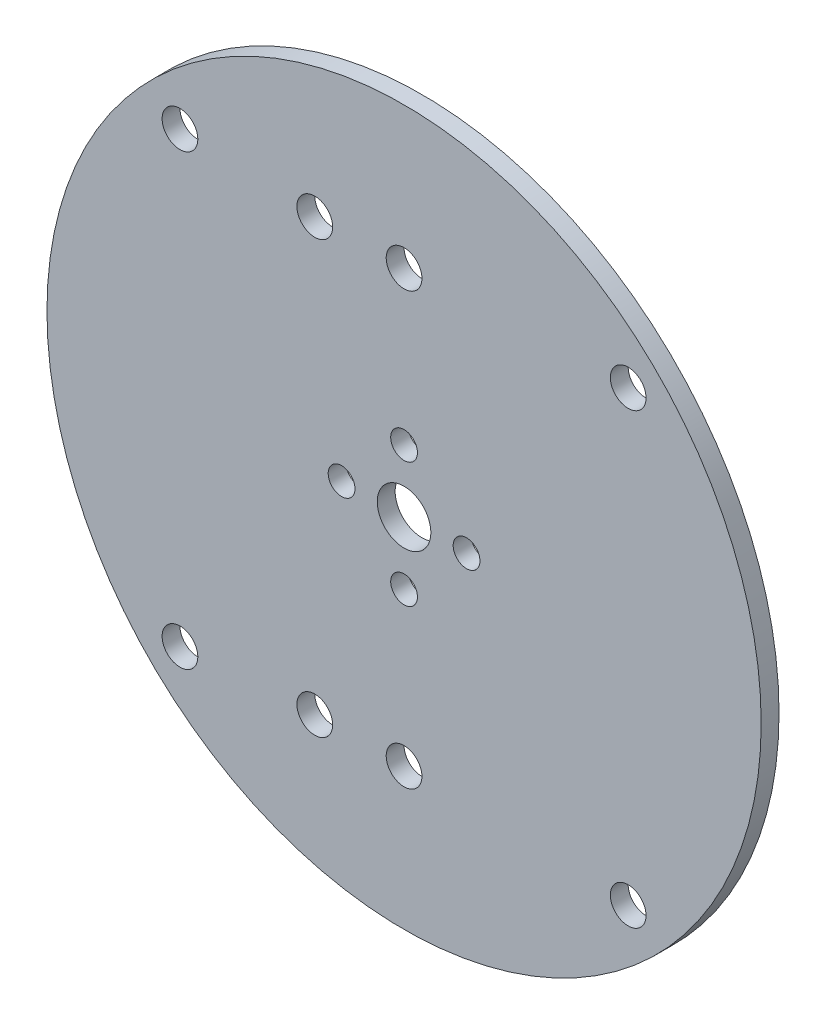
from build123d import *

# Parameters (mm, degrees)
SKETCH_1_R      = 40
SKETCH_1_R_2    = 2
SKETCH_1_R_3    = 1.5
SKETCH_1_R_4    = 3
EXTRUDE_1_DEPTH = 2


with BuildPart() as part:
    # 草图1 → 凸台-拉伸1 (new body)
    with BuildSketch(Plane.XY):
        with Locations((64.742606548, 40.569294149)):
            Circle(SKETCH_1_R)
        with Locations((89.84489728, 65.671584881)):
            Circle(SKETCH_1_R_2, mode=Mode.SUBTRACT)
        with Locations((39.640315816, 15.467003417)):
            Circle(SKETCH_1_R_2, mode=Mode.SUBTRACT)
        with Locations((39.640315816, 65.671584881)):
            Circle(SKETCH_1_R_2, mode=Mode.SUBTRACT)
        with Locations((54.742606548, 64.714294149)):
            Circle(SKETCH_1_R_2, mode=Mode.SUBTRACT)
        with Locations((64.742606548, 64.714294149)):
            Circle(SKETCH_1_R_2, mode=Mode.SUBTRACT)
        with Locations((89.84489728, 15.467003417)):
            Circle(SKETCH_1_R_2, mode=Mode.SUBTRACT)
        with Locations((64.742606548, 16.414294149)):
            Circle(SKETCH_1_R_2, mode=Mode.SUBTRACT)
        with Locations((57.742606548, 40.569294149)):
            Circle(SKETCH_1_R_3, mode=Mode.SUBTRACT)
        with Locations((64.742606548, 33.569294149)):
            Circle(SKETCH_1_R_3, mode=Mode.SUBTRACT)
        with Locations((71.742606548, 40.569294149)):
            Circle(SKETCH_1_R_3, mode=Mode.SUBTRACT)
        with Locations((64.742606548, 47.569294149)):
            Circle(SKETCH_1_R_3, mode=Mode.SUBTRACT)
        with Locations((64.742606548, 40.569294149)):
            Circle(SKETCH_1_R_4, mode=Mode.SUBTRACT)
        with Locations((54.742606548, 16.414294149)):
            Circle(SKETCH_1_R_2, mode=Mode.SUBTRACT)
    extrude(amount=EXTRUDE_1_DEPTH)


solid = part.part
